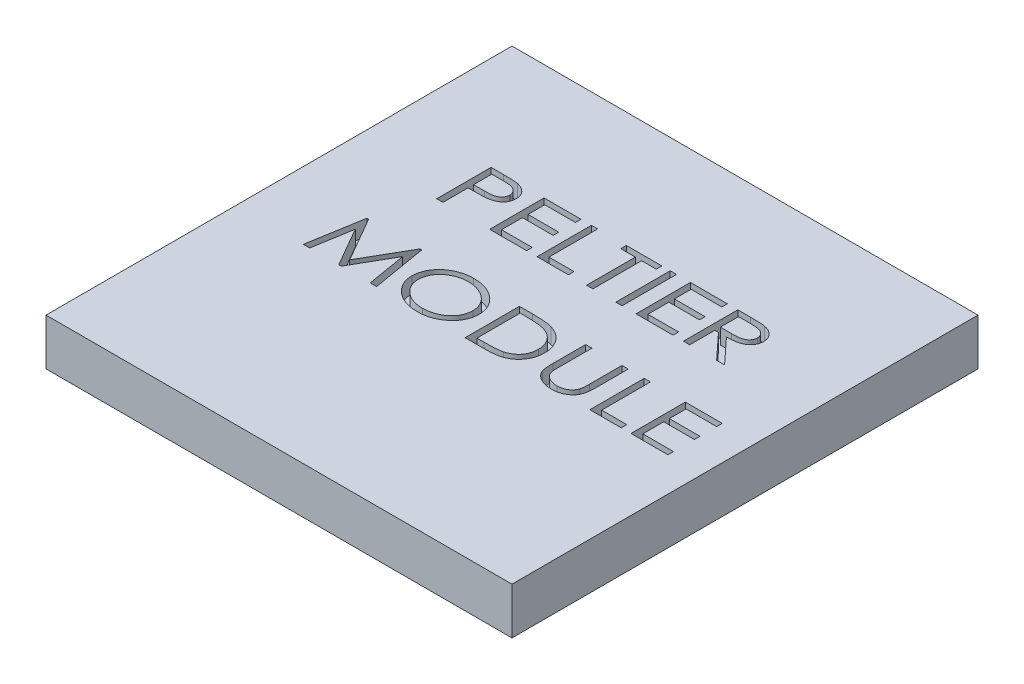
from build123d import *

# Parameters (mm, degrees)
SKETCH1_W           = 30
SKETCH1_H           = 30
BOSS_EXTRUDE1_DEPTH = 3
SKETCH2_W           = 0.403846154
SKETCH2_H           = 3.5
CUT_EXTRUDE1_DEPTH  = 1


with BuildPart() as part:
    # Sketch1 → Boss-Extrude1 (new body)
    with BuildSketch(Plane(origin=(0, 0, 0), x_dir=(1, 0, 0), z_dir=(0, 1, 0))):
        Rectangle(SKETCH1_W, SKETCH1_H)
    extrude(amount=BOSS_EXTRUDE1_DEPTH)

    # Sketch2 → Cut-Extrude1 (cut)
    # profile 1 of 13: a face of its own
    with BuildSketch(Plane(origin=(0, 3, 0), x_dir=(1, 0, 0), z_dir=(0, 1, 0))):
        with BuildLine():
            Line((-8.910711242, 7.563895489), (-8.095306594, 7.563895489))
            add(Edge.make_bspline(
                [(-8.095306594, 7.563895489), (-8.039215078, 7.563845929), (-7.93193196, 7.563751137), (-7.777913226, 7.560713176), (-7.638136947, 7.556722187), (-7.51262609, 7.55110147), (-7.401525172, 7.544576187), (-7.304786277, 7.53521498), (-7.221800478, 7.525622927), (-7.171651549, 7.515792401), (-7.148792171, 7.511311354)],
                knots=[0, 0, 0, 0, 1.418218073, 2.712546675, 3.894916518, 4.953717513, 5.889237769, 6.708316399, 7.411212084, 8, 8, 8, 8], degree=3))
            add(Edge.make_bspline(
                [(-7.148792171, 7.511311354), (-7.120180773, 7.504678722), (-7.063623726, 7.49156779), (-6.981802125, 7.465647208), (-6.904071233, 7.434556647), (-6.830282582, 7.398684752), (-6.760127224, 7.358373522), (-6.694566631, 7.312190043), (-6.632673974, 7.26184546), (-6.575386384, 7.206364012), (-6.522638047, 7.147511931), (-6.477441084, 7.083539156), (-6.439045803, 7.016364246), (-6.406578452, 6.945543321), (-6.383556401, 6.870374439), (-6.365576633, 6.791951989), (-6.354977735, 6.709751207), (-6.35367934, 6.65363563), (-6.353018934, 6.625093405)],
                knots=[0, 0, 0, 0, 1.086341783, 2.147405818, 3.171829542, 4.181180362, 5.180780209, 6.161883427, 7.145042111, 8.129606692, 9.109794985, 10.064714252, 11.021393595, 11.969594772, 12.940393889, 13.924236774, 14.944198669, 16, 16, 16, 16], degree=3))
            add(Edge.make_bspline(
                [(-6.353018934, 6.625093405), (-6.353742616, 6.596323847), (-6.355159016, 6.540015649), (-6.36479729, 6.457288029), (-6.382524611, 6.378753171), (-6.406562049, 6.303963221), (-6.436299881, 6.232520996), (-6.47493443, 6.165896317), (-6.518897678, 6.102270069), (-6.570486337, 6.043616769), (-6.627439928, 5.988694086), (-6.689853016, 5.938270118), (-6.757426746, 5.892587686), (-6.829902785, 5.851824839), (-6.907617815, 5.816046631), (-6.990259979, 5.784535955), (-7.078393482, 5.757764987), (-7.139348781, 5.743876133), (-7.170526947, 5.736772091)],
                knots=[0, 0, 0, 0, 1.045861245, 2.046974867, 3.021934933, 3.967695345, 4.900313686, 5.828704379, 6.76205769, 7.707550943, 8.662917084, 9.635505162, 10.620482456, 11.624763484, 12.654874111, 13.727818363, 14.837796611, 16, 16, 16, 16], degree=3))
            add(Edge.make_bspline(
                [(-7.170526947, 5.736772091), (-7.196199606, 5.732109913), (-7.252480653, 5.721889223), (-7.345151823, 5.710427421), (-7.452955642, 5.700792062), (-7.575954387, 5.693409287), (-7.713858524, 5.687200555), (-7.86694369, 5.682224242), (-8.035233643, 5.679495466), (-8.152563913, 5.679353956), (-8.213796178, 5.679280104)],
                knots=[0, 0, 0, 0, 0.59852503, 1.312120248, 2.141233431, 3.081389991, 4.138754772, 5.308216838, 6.595213503, 8, 8, 8, 8], degree=3))
            Line((-8.213796178, 5.679280104), (-8.506865088, 5.679280104))
            Line((-8.506865088, 5.679280104), (-8.506865088, 4.063895489))
            Line((-8.506865088, 4.063895489), (-8.910711242, 4.063895489))
            Line((-8.910711242, 4.063895489), (-8.910711242, 7.563895489))
        make_face()
        with BuildLine():
            Line((-8.506865088, 7.20492113), (-8.506865088, 6.038254463))
            Line((-8.506865088, 6.038254463), (-7.804341049, 6.030542123))
            add(Edge.make_bspline(
                [(-7.804341049, 6.030542123), (-7.769981429, 6.030528234), (-7.703578999, 6.030501392), (-7.60775602, 6.034469116), (-7.518901589, 6.039080743), (-7.437256617, 6.045843593), (-7.362744004, 6.055281771), (-7.295364611, 6.064963714), (-7.23542628, 6.078855018), (-7.165554856, 6.097407277), (-7.087683518, 6.129139853), (-7.00308606, 6.17553439), (-6.930358918, 6.234060987), (-6.868034104, 6.300495), (-6.819444467, 6.374919714), (-6.782433054, 6.453660401), (-6.760895051, 6.537486901), (-6.75821443, 6.594827613), (-6.756865088, 6.623691162)],
                knots=[0, 0, 0, 0, 1.216884587, 2.351716704, 3.39634486, 4.368394386, 5.252429777, 6.056753736, 6.777742383, 7.430440621, 8.615602712, 9.746078915, 10.835909208, 11.907861826, 12.959387667, 13.97058409, 14.978454535, 16, 16, 16, 16], degree=3))
            add(Edge.make_bspline(
                [(-6.756865088, 6.623691162), (-6.758223035, 6.651857945), (-6.76093217, 6.708051298), (-6.782600329, 6.790415645), (-6.819387308, 6.868338843), (-6.868319303, 6.94177553), (-6.928980304, 7.008160321), (-7.0000863, 7.064499039), (-7.07940089, 7.111763729), (-7.153640244, 7.140624079), (-7.219683165, 7.159032204), (-7.277016095, 7.171533572), (-7.341624734, 7.18191727), (-7.41348073, 7.190031287), (-7.492708756, 7.19719213), (-7.579466552, 7.201868008), (-7.673678774, 7.20472352), (-7.738900721, 7.20485356), (-7.772790569, 7.20492113)],
                knots=[0, 0, 0, 0, 1.024572037, 2.044043851, 3.075692791, 4.149430532, 5.245489805, 6.335123243, 7.441242237, 8.594652972, 9.222274541, 9.936592297, 10.729720506, 11.603583922, 12.568814115, 13.625561263, 14.766222551, 16, 16, 16, 16], degree=3))
            Line((-7.772790569, 7.20492113), (-8.506865088, 7.20492113))
        make_face(mode=Mode.SUBTRACT)
    # profile 2 of 13: a face of its own
    with BuildSketch(Plane(origin=(0, 3, 0), x_dir=(1, 0, 0), z_dir=(0, 1, 0))):
        Polygon((-5.500454831, 7.563895489), (-3.122249703, 7.563895489), (-3.122249703, 7.20492113), (-5.096608678, 7.20492113), (-5.096608678, 6.127998053), (-3.122249703, 6.127998053), (-3.122249703, 5.769023694), (-5.096608678, 5.769023694), (-5.096608678, 4.422869848), (-3.122249703, 4.422869848), (-3.122249703, 4.063895489), (-5.500454831, 4.063895489), align=None)
    # profile 3 of 13: a face of its own
    with BuildSketch(Plane(origin=(0, 3, 0), x_dir=(1, 0, 0), z_dir=(0, 1, 0))):
        Polygon((-2.44917278, 7.563895489), (-2.045326626, 7.563895489), (-2.045326626, 4.422869848), (-0.429942011, 4.422869848), (-0.429942011, 4.063895489), (-2.44917278, 4.063895489), align=None)
    # profile 4 of 13: a face of its own
    with BuildSketch(Plane(origin=(0, 3, 0), x_dir=(1, 0, 0), z_dir=(0, 1, 0))):
        Polygon((-0.205583037, 7.20492113), (-0.205583037, 7.563895489), (2.082878502, 7.563895489), (2.082878502, 7.20492113), (1.14057081, 7.20492113), (1.14057081, 4.063895489), (0.736724656, 4.063895489), (0.736724656, 7.20492113), align=None)
    # profile 5 of 13: a face of its own
    with BuildSketch(Plane(origin=(0, 3, 0), x_dir=(1, 0, 0), z_dir=(0, 1, 0))):
        with Locations((2.823263117, 5.813895489)):
            Rectangle(SKETCH2_W, SKETCH2_H)
    # profile 6 of 13: a face of its own
    with BuildSketch(Plane(origin=(0, 3, 0), x_dir=(1, 0, 0), z_dir=(0, 1, 0))):
        Polygon((3.922622092, 7.563895489), (6.30082722, 7.563895489), (6.30082722, 7.20492113), (4.326468245, 7.20492113), (4.326468245, 6.127998053), (6.30082722, 6.127998053), (6.30082722, 5.769023694), (4.326468245, 5.769023694), (4.326468245, 4.422869848), (6.30082722, 4.422869848), (6.30082722, 4.063895489), (3.922622092, 4.063895489), align=None)
    # profile 7 of 13: a face of its own
    with BuildSketch(Plane(origin=(0, 3, 0), x_dir=(1, 0, 0), z_dir=(0, 1, 0))):
        with BuildLine():
            Line((6.973904143, 7.563895489), (7.802630104, 7.563895489))
            add(Edge.make_bspline(
                [(7.802630104, 7.563895489), (7.858018438, 7.563739907), (7.96435906, 7.563441204), (8.116765285, 7.561774988), (8.255330454, 7.55699255), (8.37973811, 7.552928457), (8.490240779, 7.54533856), (8.586652268, 7.538363709), (8.66923959, 7.528737655), (8.719258824, 7.520147571), (8.74213331, 7.516219207)],
                knots=[0, 0, 0, 0, 1.411630423, 2.710203546, 3.884117758, 4.945139696, 5.88215703, 6.706718827, 7.408564682, 8, 8, 8, 8], degree=3))
            add(Edge.make_bspline(
                [(8.74213331, 7.516219207), (8.772392501, 7.509895177), (8.832046959, 7.497427675), (8.918184832, 7.471222054), (9.000065367, 7.440090579), (9.078037992, 7.404803787), (9.151144738, 7.362999684), (9.220073394, 7.316648861), (9.285060721, 7.265362708), (9.344671736, 7.208684276), (9.400045555, 7.148908322), (9.446662733, 7.083923632), (9.487318962, 7.016482375), (9.519528815, 6.945047536), (9.544813362, 6.870589956), (9.563089413, 6.792662564), (9.574688824, 6.71144798), (9.575870115, 6.655982213), (9.576468245, 6.627897893)],
                knots=[0, 0, 0, 0, 1.11641643, 2.200958269, 3.248516537, 4.279957034, 5.289565817, 6.287204707, 7.27885839, 8.276390078, 9.256727559, 10.217710867, 11.160418021, 12.097511966, 13.042749274, 13.99714418, 14.985881811, 16, 16, 16, 16], degree=3))
            add(Edge.make_bspline(
                [(9.576468245, 6.627897893), (9.575812082, 6.60428079), (9.574516442, 6.557647133), (9.567754567, 6.488641821), (9.554968452, 6.422109823), (9.537468043, 6.357518422), (9.514166449, 6.295587542), (9.486722765, 6.23512929), (9.453798855, 6.177239659), (9.415894308, 6.121580319), (9.372840843, 6.069380573), (9.326731379, 6.018969781), (9.275240237, 5.972932825), (9.219689624, 5.929706161), (9.159135067, 5.891005259), (9.095182729, 5.853923609), (9.026335413, 5.821313091), (8.952930241, 5.791491341), (8.873648341, 5.765723987), (8.788169172, 5.742232616), (8.695246909, 5.7239771), (8.59546106, 5.707560976), (8.488289099, 5.695227698), (8.373934223, 5.686223904), (8.252572865, 5.680557719), (8.169323085, 5.679713747), (8.126548374, 5.679280104)],
                knots=[0, 0, 0, 0, 0.870437867, 1.718741786, 2.551384448, 3.36406043, 4.181467661, 4.986810527, 5.808199835, 6.632248171, 7.464757229, 8.299534648, 9.147007689, 10.006514551, 10.890268779, 11.792828836, 12.72878645, 13.694651385, 14.710400546, 15.798752409, 16.958998952, 18.197760763, 19.524398659, 20.932521486, 22.423893651, 24, 24, 24, 24], degree=3))
            Line((8.126548374, 5.679280104), (9.62134004, 4.063895489))
            Line((9.62134004, 4.063895489), (9.10952113, 4.063895489))
            Line((9.10952113, 4.063895489), (7.614729463, 5.679280104))
            Line((7.614729463, 5.679280104), (7.377750297, 5.679280104))
            Line((7.377750297, 5.679280104), (7.377750297, 4.063895489))
            Line((7.377750297, 4.063895489), (6.973904143, 4.063895489))
            Line((6.973904143, 4.063895489), (6.973904143, 7.563895489))
        make_face()
        with BuildLine():
            Line((7.377750297, 7.20492113), (7.377750297, 6.038254463))
            Line((7.377750297, 6.038254463), (8.110422572, 6.033346611))
            add(Edge.make_bspline(
                [(8.110422572, 6.033346611), (8.144782431, 6.033330192), (8.211185321, 6.033298461), (8.307238299, 6.037309795), (8.396336381, 6.041821742), (8.478421887, 6.048779529), (8.553732169, 6.057850216), (8.622101401, 6.068764254), (8.683666959, 6.082104635), (8.755351345, 6.102133661), (8.835582051, 6.13350646), (8.922144667, 6.180712905), (8.996928573, 6.238454124), (9.059908648, 6.30545556), (9.109502033, 6.379592644), (9.146099997, 6.458709521), (9.168822059, 6.542271707), (9.1713506, 6.599713879), (9.172622092, 6.628599014)],
                knots=[0, 0, 0, 0, 1.205111977, 2.328965291, 3.371672642, 4.334318186, 5.217938529, 6.031964904, 6.761988022, 7.426368084, 8.641199984, 9.775054944, 10.873689325, 11.940859355, 12.986752222, 13.988165942, 14.988337359, 16, 16, 16, 16], degree=3))
            add(Edge.make_bspline(
                [(9.172622092, 6.628599014), (9.17134703, 6.656786114), (9.168810789, 6.712853444), (9.146034053, 6.794650965), (9.10893679, 6.872012385), (9.057982536, 6.944004403), (8.996243978, 7.009631687), (8.923609676, 7.06551487), (8.842239132, 7.111414976), (8.766788447, 7.140857847), (8.699472987, 7.158880856), (8.640813585, 7.171701584), (8.574297722, 7.181922624), (8.499876857, 7.190019788), (8.417843871, 7.197180983), (8.327818006, 7.201898363), (8.23009938, 7.204708546), (8.162307652, 7.204848667), (8.127249495, 7.20492113)],
                knots=[0, 0, 0, 0, 1.007089001, 2.003213978, 3.013250479, 4.064283037, 5.146917847, 6.225928548, 7.33072321, 8.480016439, 9.113044939, 9.823344944, 10.627712821, 11.519897955, 12.501985578, 13.574102818, 14.745459281, 16, 16, 16, 16], degree=3))
            Line((8.127249495, 7.20492113), (7.377750297, 7.20492113))
        make_face(mode=Mode.SUBTRACT)
    # profile 8 of 13: a face of its own
    with BuildSketch(Plane(origin=(0, 3, 0), x_dir=(1, 0, 0), z_dir=(0, 1, 0))):
        Polygon((-10.660711242, -2.769437845), (-10.072470056, 0.730562155), (-9.959589447, 0.730562155), (-8.304942011, -2.141232716), (-6.65239794, 0.730562155), (-6.538115088, 0.730562155), (-5.94917278, -2.769437845), (-6.356524543, -2.769437845), (-6.779300985, -0.256617332), (-8.225014126, -2.769437845), (-8.383467652, -2.769437845), (-9.830583037, -0.256617332), (-10.252658357, -2.769437845), align=None)
    # profile 9 of 13: a face of its own
    with BuildSketch(Plane(origin=(0, 3, 0), x_dir=(1, 0, 0), z_dir=(0, 1, 0))):
        with BuildLine():
            add(Edge.make_bspline(
                [(-3.283507716, 0.820305745), (-3.207726288, 0.818658223), (-3.058795007, 0.815420392), (-2.839845063, 0.790836848), (-2.630657845, 0.748324731), (-2.430240094, 0.691566364), (-2.240260222, 0.615645191), (-2.059160064, 0.524604406), (-1.887947101, 0.415822056), (-1.754238717, 0.312109207), (-1.653347657, 0.222658709), (-1.58261497, 0.153230678), (-1.516440416, 0.0820887), (-1.454551089, 0.009540018), (-1.398419826, -0.06583176), (-1.347241624, -0.142889427), (-1.300865475, -0.221863564), (-1.258466903, -0.302253113), (-1.222040304, -0.385321581), (-1.190823006, -0.470249754), (-1.16279844, -0.556533465), (-1.14167831, -0.645298951), (-1.123485107, -0.735681378), (-1.112351406, -0.828298354), (-1.103781405, -0.922523033), (-1.103274697, -0.985996843), (-1.103018934, -1.018035601)],
                knots=[0, 0, 0, 0, 1.716972486, 3.374321645, 4.984099859, 6.549504726, 8.087519931, 9.612717966, 11.136223442, 12.676379645, 13.441598931, 14.190556771, 14.92122448, 15.642680141, 16.350182031, 17.049310351, 17.737747048, 18.42465445, 19.107528592, 19.791182575, 20.474508313, 21.16166063, 21.857512067, 22.562313407, 23.274319711, 24, 24, 24, 24], degree=3))
            add(Edge.make_bspline(
                [(-1.103018934, -1.018035601), (-1.103275256, -1.049840601), (-1.10378304, -1.112847629), (-1.112343662, -1.206374582), (-1.123512735, -1.298281359), (-1.141576527, -1.38800426), (-1.163209006, -1.476066251), (-1.189558596, -1.562439876), (-1.222426198, -1.646551959), (-1.258482008, -1.729471245), (-1.300286154, -1.8102758), (-1.34612155, -1.889478775), (-1.398176483, -1.966179906), (-1.453557385, -2.041897323), (-1.515510716, -2.114885769), (-1.580713981, -2.187196793), (-1.652219337, -2.256567308), (-1.752455001, -2.346893068), (-1.885609335, -2.450800595), (-2.054932121, -2.560264182), (-2.232760199, -2.653576688), (-2.420130429, -2.728034424), (-2.615257836, -2.787939803), (-2.819445565, -2.828327248), (-3.031818766, -2.854632329), (-3.176389091, -2.857648658), (-3.24985387, -2.859181434)],
                knots=[0, 0, 0, 0, 0.727688424, 1.441581025, 2.148221707, 2.845876066, 3.53480076, 4.223455413, 4.910924792, 5.600721201, 6.292133594, 6.992162883, 7.693927321, 8.412892544, 9.138217697, 9.884159413, 10.640709408, 11.417249897, 12.972080266, 14.500394009, 16.026909228, 17.560643203, 19.109046397, 20.692137365, 22.319078304, 24, 24, 24, 24], degree=3))
            add(Edge.make_bspline(
                [(-3.24985387, -2.859181434), (-3.324250743, -2.857648966), (-3.470447338, -2.854637527), (-3.685183346, -2.82840773), (-3.891273103, -2.787651867), (-4.088470737, -2.729297726), (-4.276670877, -2.65386989), (-4.456174891, -2.56187253), (-4.626390455, -2.452340033), (-4.760230567, -2.348925428), (-4.861045967, -2.25939473), (-4.932066784, -2.190001066), (-4.997537115, -2.118424815), (-5.059461864, -2.046111909), (-5.115008312, -1.970809494), (-5.167256394, -1.89480847), (-5.213657823, -1.816484072), (-5.255021174, -1.73662204), (-5.291503681, -1.654825927), (-5.323988184, -1.571735261), (-5.350668651, -1.486401223), (-5.372037152, -1.399433261), (-5.390237068, -1.310914551), (-5.401381708, -1.220398806), (-5.409949089, -1.128275129), (-5.410455555, -1.066200553), (-5.410711242, -1.034862524)],
                knots=[0, 0, 0, 0, 1.703062041, 3.346671193, 4.946203512, 6.509138321, 8.048521944, 9.58276185, 11.120758737, 12.677220522, 13.450541159, 14.20742819, 14.949757975, 15.671309589, 16.386301778, 17.091370882, 17.782490653, 18.469453774, 19.149776582, 19.83255775, 20.511300002, 21.195338441, 21.882801688, 22.579144075, 23.282688219, 24, 24, 24, 24], degree=3))
            add(Edge.make_bspline(
                [(-5.410711242, -1.034862524), (-5.409963795, -0.993226666), (-5.408477601, -0.910439496), (-5.394653942, -0.787390096), (-5.372321285, -0.66643945), (-5.340632465, -0.547914111), (-5.300371282, -0.431789093), (-5.252117371, -0.317574082), (-5.193595562, -0.206339114), (-5.126915422, -0.097784549), (-5.053238711, 0.007131397), (-4.971389424, 0.10601012), (-4.883866842, 0.199531965), (-4.789426522, 0.286620141), (-4.688959307, 0.368110214), (-4.58200643, 0.444084088), (-4.468479707, 0.514227187), (-4.348708891, 0.57742044), (-4.225279381, 0.635242254), (-4.097788008, 0.68398122), (-3.968244041, 0.726279638), (-3.836175909, 0.760582542), (-3.701598559, 0.787539327), (-3.564339704, 0.80588102), (-3.424676159, 0.818712788), (-3.330745984, 0.819772704), (-3.283507716, 0.820305745)],
                knots=[0, 0, 0, 0, 0.955373341, 1.899628329, 2.838106133, 3.776246603, 4.712667854, 5.657212297, 6.619338538, 7.594535323, 8.579800931, 9.559222777, 10.538306702, 11.517655096, 12.505385458, 13.505607414, 14.526839826, 15.565921102, 16.61232893, 17.653333061, 18.696601328, 19.738765753, 20.783412182, 21.8447281, 22.916095796, 24, 24, 24, 24], degree=3))
        make_face()
        with BuildLine():
            add(Edge.make_bspline(
                [(-3.265278549, 0.461331386), (-3.303163133, 0.460917316), (-3.378829009, 0.460090305), (-3.491360243, 0.449551922), (-3.602575788, 0.434383338), (-3.71226999, 0.412812739), (-3.820170998, 0.383559966), (-3.92688538, 0.349592842), (-4.031829964, 0.30842726), (-4.134632486, 0.261988317), (-4.234211473, 0.210193936), (-4.328701814, 0.153716602), (-4.417385151, 0.092189887), (-4.500941904, 0.027391078), (-4.578300162, -0.042402537), (-4.650189703, -0.116421599), (-4.716834399, -0.194633087), (-4.776842747, -0.277425253), (-4.831054211, -0.362943916), (-4.878400614, -0.451342727), (-4.917254069, -0.542931783), (-4.950678861, -0.636110694), (-4.976139407, -0.732028517), (-4.99302207, -0.830390805), (-5.005168657, -0.931029941), (-5.00629549, -0.999067989), (-5.006865088, -1.03346028)],
                knots=[0, 0, 0, 0, 1.069612696, 2.136309105, 3.189254904, 4.23907214, 5.290962313, 6.34508668, 7.400450221, 8.47276815, 9.529678617, 10.568838592, 11.579496799, 12.576374385, 13.553186778, 14.51941594, 15.488796248, 16.452564884, 17.404805125, 18.346741125, 19.281037577, 20.212110939, 21.140700997, 22.079393726, 23.029160135, 24, 24, 24, 24], degree=3))
            add(Edge.make_bspline(
                [(-5.006865088, -1.03346028), (-5.005588741, -1.084058223), (-5.003073472, -1.183770459), (-4.976982092, -1.32959694), (-4.938426015, -1.470010111), (-4.881238507, -1.603696018), (-4.809752182, -1.73245819), (-4.720321117, -1.853611952), (-4.616473861, -1.969778359), (-4.497332465, -2.077636855), (-4.367370359, -2.176408897), (-4.229304834, -2.263267427), (-4.084411409, -2.336378869), (-3.932898956, -2.395907611), (-3.77546717, -2.443512509), (-3.611031902, -2.47574127), (-3.440423388, -2.497126788), (-3.32423976, -2.49917012), (-3.265278549, -2.500207075)],
                knots=[0, 0, 0, 0, 0.95883563, 1.889555991, 2.801784012, 3.715734031, 4.640671425, 5.589492724, 6.565878031, 7.592042983, 8.633002388, 9.658860845, 10.681908685, 11.706856694, 12.743388558, 13.797155375, 14.882093918, 16, 16, 16, 16], degree=3))
            add(Edge.make_bspline(
                [(-3.265278549, -2.500207075), (-3.22553107, -2.499723958), (-3.14663025, -2.498764943), (-3.029586865, -2.489396908), (-2.914663973, -2.473966961), (-2.802107235, -2.452243715), (-2.691712791, -2.424668279), (-2.583423387, -2.392281069), (-2.478082686, -2.351441462), (-2.374723113, -2.306659364), (-2.275674132, -2.255413289), (-2.181257903, -2.200181014), (-2.092903152, -2.139712258), (-2.010015313, -2.075092157), (-1.932384675, -2.006550095), (-1.861692706, -1.932246717), (-1.795285318, -1.854511902), (-1.735329791, -1.771836231), (-1.681293883, -1.686068518), (-1.634996209, -1.597294412), (-1.595387146, -1.506470167), (-1.563202069, -1.413126526), (-1.537917981, -1.317512737), (-1.519463694, -1.219615125), (-1.508900465, -1.119232638), (-1.507547128, -1.051479809), (-1.506865088, -1.017334479)],
                knots=[0, 0, 0, 0, 1.117065032, 2.217432405, 3.297913234, 4.37497383, 5.437675127, 6.495390293, 7.54950903, 8.611377544, 9.660243097, 10.682100067, 11.684235004, 12.667152348, 13.634938135, 14.592007531, 15.547520073, 16.506706334, 17.45998069, 18.394371928, 19.318196599, 20.242675007, 21.166849952, 22.09579874, 23.040341461, 24, 24, 24, 24], degree=3))
            add(Edge.make_bspline(
                [(-1.506865088, -1.017334479), (-1.507547483, -0.983422824), (-1.508901473, -0.916136197), (-1.519458544, -0.816450238), (-1.537936319, -0.719259647), (-1.563082673, -0.62453175), (-1.595407937, -0.532391087), (-1.635002117, -0.442961278), (-1.681327464, -0.355602521), (-1.735301469, -0.271184428), (-1.795580628, -0.189955496), (-1.861633718, -0.112409618), (-1.934073422, -0.039581114), (-2.0120797, 0.029250087), (-2.095807353, 0.094060464), (-2.185697854, 0.154183063), (-2.281231229, 0.210326471), (-2.381916641, 0.262000634), (-2.486124321, 0.30841702), (-2.592652593, 0.349750802), (-2.701091842, 0.383416681), (-2.810791581, 0.412940066), (-2.922163821, 0.434290572), (-3.035220283, 0.449615495), (-3.14963007, 0.460079524), (-3.226693834, 0.460913717), (-3.265278549, 0.461331386)],
                knots=[0, 0, 0, 0, 0.956495168, 1.897852899, 2.823637996, 3.744740073, 4.660067454, 5.575109893, 6.501176627, 7.4467035, 8.398689559, 9.352591177, 10.317568584, 11.293741, 12.285374122, 13.3020035, 14.342214683, 15.409564574, 16.492618615, 17.559011159, 18.630709222, 19.694081511, 20.762042026, 21.826782655, 22.911901395, 24, 24, 24, 24], degree=3))
        make_face(mode=Mode.SUBTRACT)
    # profile 10 of 13: a face of its own
    with BuildSketch(Plane(origin=(0, 3, 0), x_dir=(1, 0, 0), z_dir=(0, 1, 0))):
        with BuildLine():
            Line((-0.250454831, -2.769437845), (-0.250454831, 0.730562155))
            Line((-0.250454831, 0.730562155), (0.588787957, 0.730562155))
            add(Edge.make_bspline(
                [(0.588787957, 0.730562155), (0.661941754, 0.730121067), (0.803130117, 0.729269758), (1.006982246, 0.723843567), (1.195202287, 0.714292319), (1.367722471, 0.700206836), (1.524963631, 0.683207299), (1.666737617, 0.661587814), (1.793071218, 0.636488278), (1.871016278, 0.614622464), (1.907598053, 0.604360232)],
                knots=[0, 0, 0, 0, 1.3211948, 2.549933714, 3.682670825, 4.72443222, 5.675778669, 6.538377397, 7.314020028, 8, 8, 8, 8], degree=3))
            add(Edge.make_bspline(
                [(1.907598053, 0.604360232), (1.955524054, 0.588934366), (2.050030806, 0.558515626), (2.185515411, 0.501442698), (2.312771277, 0.435894903), (2.43288734, 0.36311636), (2.543915987, 0.280729909), (2.648201622, 0.19163907), (2.742612324, 0.092770974), (2.829782497, -0.01285458), (2.907308333, -0.125510495), (2.975210902, -0.243789895), (3.031724397, -0.367707242), (3.079417599, -0.496342445), (3.114779517, -0.631033548), (3.14047782, -0.770707793), (3.157462743, -0.915488859), (3.159014786, -1.013780543), (3.159801579, -1.063608518)],
                knots=[0, 0, 0, 0, 1.07436122, 2.118565874, 3.133765883, 4.127984174, 5.11282082, 6.081965103, 7.052225859, 8.026990791, 9.002585186, 9.967895436, 10.934455346, 11.906676447, 12.892927292, 13.902719417, 14.936804816, 16, 16, 16, 16], degree=3))
            add(Edge.make_bspline(
                [(3.159801579, -1.063608518), (3.158931588, -1.106867033), (3.157216479, -1.192147328), (3.145484324, -1.318070804), (3.124045509, -1.439777649), (3.095401311, -1.557631159), (3.059118113, -1.672047119), (3.013152057, -1.781921559), (2.960020653, -1.888378054), (2.897998952, -1.989567404), (2.830541141, -2.086002782), (2.757014147, -2.176263558), (2.679083268, -2.260226162), (2.595413411, -2.33699788), (2.508039407, -2.408109505), (2.41488393, -2.472205804), (2.316701044, -2.529374486), (2.213299653, -2.581467336), (2.102032633, -2.626709462), (1.981018267, -2.665076816), (1.849501114, -2.696973355), (1.707426917, -2.723482829), (1.55488464, -2.744433066), (1.391556059, -2.758690134), (1.218039951, -2.768140901), (1.098750516, -2.768997868), (1.037505906, -2.769437845)],
                knots=[0, 0, 0, 0, 1.007638568, 1.986469346, 2.942307766, 3.883713129, 4.809932898, 5.734968058, 6.655233433, 7.578585121, 8.496851739, 9.394671617, 10.288256471, 11.162750193, 12.037599673, 12.910397323, 13.793641343, 14.68225427, 15.605220733, 16.588265974, 17.636610196, 18.755552882, 19.95349296, 21.221625563, 22.573549637, 24, 24, 24, 24], degree=3))
            Line((1.037505906, -2.769437845), (-0.250454831, -2.769437845))
        make_face()
        with BuildLine():
            Line((0.153391322, -2.410463486), (0.619637316, -2.410463486))
            add(Edge.make_bspline(
                [(0.619637316, -2.410463486), (0.686713641, -2.410217138), (0.815505271, -2.409744131), (1.000632208, -2.405548883), (1.169642705, -2.398710117), (1.322785815, -2.389126347), (1.459775107, -2.376523568), (1.581024841, -2.362284921), (1.6862556, -2.344774491), (1.750391767, -2.328795937), (1.779993886, -2.321421018)],
                knots=[0, 0, 0, 0, 1.380201592, 2.650091708, 3.810045458, 4.860555721, 5.807075929, 6.640357142, 7.372455316, 8, 8, 8, 8], degree=3))
            add(Edge.make_bspline(
                [(1.779993886, -2.321421018), (1.817076601, -2.310212999), (1.889937025, -2.288191392), (1.995133714, -2.247396644), (2.093771402, -2.199536118), (2.187082572, -2.146423316), (2.273496947, -2.085870392), (2.353498113, -2.018817391), (2.428536058, -1.946593283), (2.496309106, -1.867268964), (2.557195134, -1.782545754), (2.610766799, -1.693356186), (2.65600184, -1.599540154), (2.692321429, -1.500811932), (2.72120217, -1.397693256), (2.741397454, -1.290018412), (2.75347533, -1.177934641), (2.755118308, -1.101733036), (2.755955425, -1.062907396)],
                knots=[0, 0, 0, 0, 1.078749559, 2.11953602, 3.138517028, 4.12999422, 5.106941517, 6.072897317, 7.034985234, 8.004378337, 8.974470542, 9.9378788, 10.898644562, 11.870787474, 12.864185929, 13.877851293, 14.918739528, 16, 16, 16, 16], degree=3))
            add(Edge.make_bspline(
                [(2.755955425, -1.062907396), (2.755225271, -1.021971941), (2.753790115, -0.941511152), (2.74016566, -0.823303556), (2.717658934, -0.709865476), (2.686656661, -0.60086605), (2.647820467, -0.495779739), (2.598002973, -0.396036613), (2.54057757, -0.300436355), (2.474579164, -0.209716642), (2.400297285, -0.125398138), (2.319432691, -0.046677845), (2.230500816, 0.023693917), (2.135941157, 0.08891216), (2.033371862, 0.145387508), (1.924727147, 0.196256816), (1.808432693, 0.238978354), (1.727805736, 0.261805513), (1.686744688, 0.273430745)],
                knots=[0, 0, 0, 0, 1.058669847, 2.080871278, 3.073316351, 4.047471421, 5.009847859, 5.967025571, 6.92717743, 7.89220902, 8.864786813, 9.831124328, 10.807453351, 11.795172645, 12.799353072, 13.832651409, 14.896230148, 16, 16, 16, 16], degree=3))
            add(Edge.make_bspline(
                [(1.686744688, 0.273430745), (1.652709091, 0.281564052), (1.579945964, 0.298951872), (1.461988211, 0.317483391), (1.328963503, 0.334378829), (1.180715598, 0.348231769), (1.016798782, 0.358419119), (0.8377414, 0.365927838), (0.643271429, 0.371063151), (0.508629939, 0.371408535), (0.438747893, 0.371587796)],
                knots=[0, 0, 0, 0, 0.669246088, 1.430750214, 2.28257198, 3.234651627, 4.278572046, 5.424227125, 6.663114321, 8, 8, 8, 8], degree=3))
            Line((0.438747893, 0.371587796), (0.153391322, 0.371587796))
            Line((0.153391322, 0.371587796), (0.153391322, -2.410463486))
        make_face(mode=Mode.SUBTRACT)
    # profile 11 of 13: a face of its own
    with BuildSketch(Plane(origin=(0, 3, 0), x_dir=(1, 0, 0), z_dir=(0, 1, 0))):
        with BuildLine():
            Line((4.012365681, 0.730562155), (4.416211835, 0.730562155))
            Line((4.416211835, 0.730562155), (4.416211835, -1.366493133))
            add(Edge.make_bspline(
                [(4.416211835, -1.366493133), (4.416028679, -1.396175985), (4.41568109, -1.452507386), (4.418002868, -1.532648502), (4.417684651, -1.603966202), (4.420575751, -1.666561825), (4.421677033, -1.720408075), (4.426206068, -1.765390796), (4.427828913, -1.801824474), (4.431470341, -1.822942262), (4.433038758, -1.832038005)],
                knots=[0, 0, 0, 0, 1.527959972, 2.899725649, 4.126965073, 5.198348317, 6.125452099, 6.89779394, 7.525263567, 8, 8, 8, 8], degree=3))
            add(Edge.make_bspline(
                [(4.433038758, -1.832038005), (4.439273089, -1.864941691), (4.451442147, -1.929167804), (4.482293037, -2.020208073), (4.524298012, -2.102673019), (4.576580814, -2.177856854), (4.643233886, -2.244806703), (4.723121423, -2.306300026), (4.819226382, -2.360443391), (4.92709296, -2.40919871), (5.043119227, -2.449091339), (5.161750532, -2.478731615), (5.281053608, -2.497109276), (5.360793164, -2.499175791), (5.400586835, -2.500207075)],
                knots=[0, 0, 0, 0, 0.937165939, 1.829294321, 2.68113389, 3.521937752, 4.382857395, 5.316313042, 6.336836783, 7.464669436, 8.627993282, 9.767822986, 10.886041953, 12, 12, 12, 12], degree=3))
            add(Edge.make_bspline(
                [(5.400586835, -2.500207075), (5.434741962, -2.499129468), (5.502837322, -2.496981032), (5.603939947, -2.483827883), (5.702474376, -2.460003778), (5.798419093, -2.429250795), (5.888611545, -2.388357372), (5.973028173, -2.341963653), (6.048186563, -2.286304356), (6.116856948, -2.225557576), (6.177083899, -2.156878465), (6.227973945, -2.081057149), (6.271052343, -1.998546264), (6.292158735, -1.939829295), (6.302930585, -1.909862524)],
                knots=[0, 0, 0, 0, 1.064886329, 2.123072678, 3.17097681, 4.221536718, 5.258621811, 6.253548821, 7.218221368, 8.167502979, 9.107118434, 10.056819295, 11.008278993, 12, 12, 12, 12], degree=3))
            add(Edge.make_bspline(
                [(6.302930585, -1.909862524), (6.306346005, -1.897512312), (6.313952553, -1.870006909), (6.32299197, -1.823669338), (6.329181347, -1.768529359), (6.33610816, -1.705030996), (6.339536517, -1.632698819), (6.343349112, -1.551623308), (6.345314346, -1.461854696), (6.345567031, -1.399212681), (6.345699015, -1.366493133)],
                knots=[0, 0, 0, 0, 0.562605183, 1.252989285, 2.070249518, 2.998541686, 4.057440162, 5.249073226, 6.563119653, 8, 8, 8, 8], degree=3))
            Line((6.345699015, -1.366493133), (6.345699015, 0.730562155))
            Line((6.345699015, 0.730562155), (6.749545169, 0.730562155))
            Line((6.749545169, 0.730562155), (6.749545169, -1.383320056))
            add(Edge.make_bspline(
                [(6.749545169, -1.383320056), (6.749428692, -1.421424036), (6.749201317, -1.49580736), (6.742983764, -1.604736525), (6.735056866, -1.708144417), (6.723198888, -1.805948214), (6.707573402, -1.897796142), (6.689846248, -1.984602372), (6.66720298, -2.065429219), (6.64212915, -2.141612783), (6.611697374, -2.213642839), (6.574251449, -2.282575802), (6.530055189, -2.349147953), (6.478853238, -2.413334913), (6.421859674, -2.47589867), (6.356344064, -2.534488627), (6.285781263, -2.592362387), (6.208344472, -2.646692321), (6.125266369, -2.69635594), (6.037327196, -2.739883629), (5.945507022, -2.777052244), (5.849239154, -2.807646271), (5.748499566, -2.830173708), (5.643656489, -2.847286206), (5.534686431, -2.857042739), (5.460668278, -2.858460409), (5.423022733, -2.859181434)],
                knots=[0, 0, 0, 0, 1.208054628, 2.358260725, 3.45866148, 4.496440954, 5.480853434, 6.412526476, 7.304291759, 8.140927087, 8.954431294, 9.780097781, 10.62486628, 11.484808869, 12.381640604, 13.304875344, 14.268994293, 15.274383434, 16.301310292, 17.335352109, 18.382614029, 19.439663046, 20.534484768, 21.652929532, 22.806282704, 24, 24, 24, 24], degree=3))
            add(Edge.make_bspline(
                [(5.423022733, -2.859181434), (5.382112113, -2.858387411), (5.301592971, -2.856824635), (5.183041181, -2.84810077), (5.069174699, -2.831441736), (4.959345673, -2.81034937), (4.854401922, -2.781165527), (4.753350403, -2.74717369), (4.65754256, -2.705507725), (4.56623884, -2.658746852), (4.48111279, -2.606512345), (4.402863945, -2.549469556), (4.331705643, -2.488368786), (4.267903229, -2.423167815), (4.210930591, -2.354131605), (4.162964625, -2.280088099), (4.120731217, -2.202733295), (4.099000093, -2.148257598), (4.088086835, -2.120900184)],
                knots=[0, 0, 0, 0, 1.209337085, 2.380183537, 3.510449503, 4.609117924, 5.683278626, 6.727458297, 7.75783763, 8.76808417, 9.757330332, 10.706526832, 11.627349168, 12.526144091, 13.40001323, 14.267910217, 15.130153452, 16, 16, 16, 16], degree=3))
            add(Edge.make_bspline(
                [(4.088086835, -2.120900184), (4.081945389, -2.102287846), (4.068658736, -2.062021155), (4.053970255, -1.995054646), (4.040573129, -1.918128392), (4.030539979, -1.830780035), (4.021988921, -1.733540139), (4.01680357, -1.62595262), (4.013218056, -1.508144049), (4.012657752, -1.426091663), (4.012365681, -1.383320056)],
                knots=[0, 0, 0, 0, 0.63157097, 1.366366353, 2.207520215, 3.148705684, 4.200004558, 5.354476267, 6.620962678, 8, 8, 8, 8], degree=3))
            Line((4.012365681, -1.383320056), (4.012365681, 0.730562155))
        make_face()
    # profile 12 of 13: a face of its own
    with BuildSketch(Plane(origin=(0, 3, 0), x_dir=(1, 0, 0), z_dir=(0, 1, 0))):
        Polygon((7.781596451, 0.730562155), (8.185442604, 0.730562155), (8.185442604, -2.410463486), (9.80082722, -2.410463486), (9.80082722, -2.769437845), (7.781596451, -2.769437845), align=None)
    # profile 13 of 13: a face of its own
    with BuildSketch(Plane(origin=(0, 3, 0), x_dir=(1, 0, 0), z_dir=(0, 1, 0))):
        Polygon((10.429032348, 0.730562155), (12.807237476, 0.730562155), (12.807237476, 0.371587796), (10.832878502, 0.371587796), (10.832878502, -0.70533528), (12.807237476, -0.70533528), (12.807237476, -1.064309639), (10.832878502, -1.064309639), (10.832878502, -2.410463486), (12.807237476, -2.410463486), (12.807237476, -2.769437845), (10.429032348, -2.769437845), align=None)
    extrude(amount=-CUT_EXTRUDE1_DEPTH, mode=Mode.SUBTRACT)


solid = part.part
